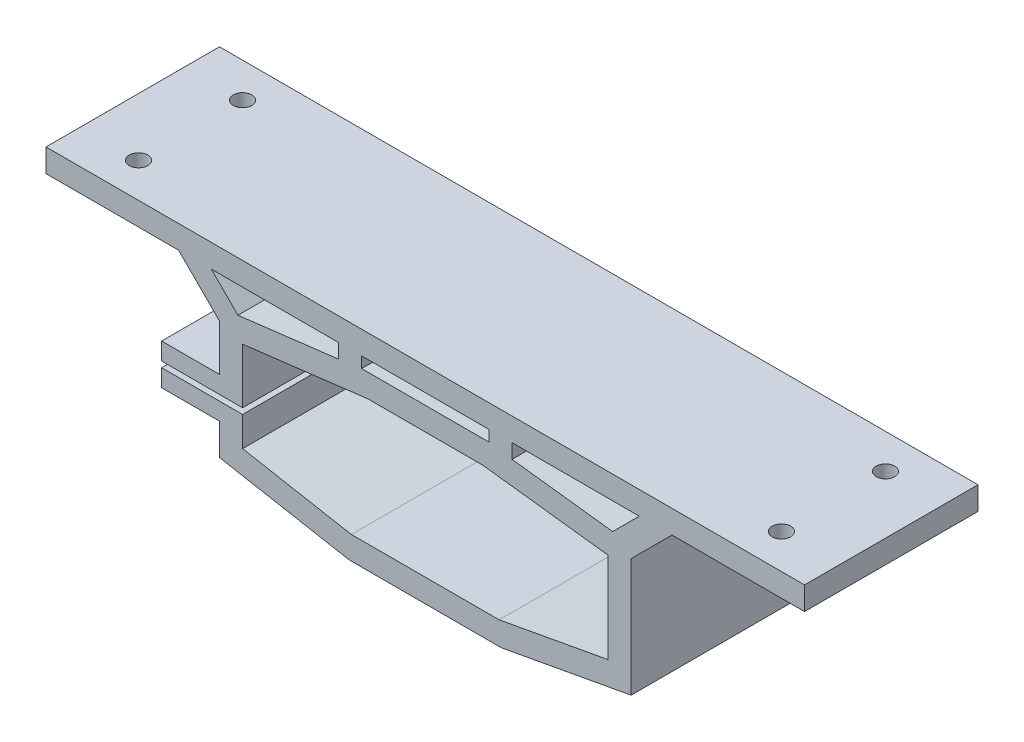
from build123d import *

# Parameters (mm, degrees)
EXTRUDE1_DEPTH      = 20
EXTRUDE1_DEPTH_BACK = 10
SKETCH2_W           = 22.028427124
SKETCH2_H           = 1.9
SKETCH3_R           = 1.6
CUT_EXTRUDE1_DEPTH  = 20
SKETCH4_R           = 2.15
CUT_EXTRUDE2_DEPTH  = 15


with BuildPart() as part:
    # Sketch2 → Extrude1 (new, two sides: drawn at the far end of the back side and taken through both)
    with BuildSketch(Plane.XY.offset(70).offset(-EXTRUDE1_DEPTH_BACK)):
        Polygon((31.6, 1.959185913), (31.6, -13.690519995), (12.781818432, -17.14052), (-12.781818445, -17.14052), (-31.6, -13.690519995), (-31.6, -8.571067812), (-45.6, -8.571067812), (-45.6, -11.571067812), (-35.6, -11.571067812), (-35.6, -17.023853319), (-13.145454814, -21.14052), (13.145454801, -21.14052), (35.6, -17.023853319), (35.6, 3.428932188), (42.671067812, 10.5), (65.6, 10.5), (65.6, 14.5), (-65.6, 14.5), (-65.6, 10.5), (-42.671067812, 10.5), (-35.6, 3.428932188), (-35.6, -4.571067812), (-45.6, -4.571067812), (-45.6, -7.571067812), (-31.6, -7.571067812), (-31.6, 1.959185913), (-9.945324486, 4.6), (9.945324486, 4.6), align=None)
        Polygon((37.014213562, 10.5), (32.404878042, 5.890664479), (15.014213562, 8.011477221), (15.014213562, 10.5), align=None, mode=Mode.SUBTRACT)
        with Locations((0, 9.55)):
            Rectangle(SKETCH2_W, SKETCH2_H, mode=Mode.SUBTRACT)
        Polygon((-15.014213562, 10.5), (-15.014213562, 8.011477221), (-32.404878042, 5.890664479), (-37.014213562, 10.5), align=None, mode=Mode.SUBTRACT)
    extrude(amount=EXTRUDE1_DEPTH + EXTRUDE1_DEPTH_BACK)

    # Sketch3 → Cut-Extrude1 (cut)
    with BuildSketch(Plane.XZ.offset(-10.5)):
        with Locations((-55.6, 84)):
            Circle(SKETCH3_R)
        with Locations((-55.6, 66)):
            Circle(SKETCH3_R)
        with Locations((55.6, 84)):
            Circle(SKETCH3_R)
        with Locations((55.6, 66)):
            Circle(SKETCH3_R)
    extrude(amount=-CUT_EXTRUDE1_DEPTH, mode=Mode.SUBTRACT)

    # Sketch4 → Cut-Extrude2 (cut)
    with BuildSketch(Plane.XZ.offset(11.571067812)):
        with Locations(Location((-41.6, 75, 0), (0, 0, 270))):
            Circle(SKETCH4_R)
    extrude(amount=-CUT_EXTRUDE2_DEPTH, mode=Mode.SUBTRACT)


solid = part.part
